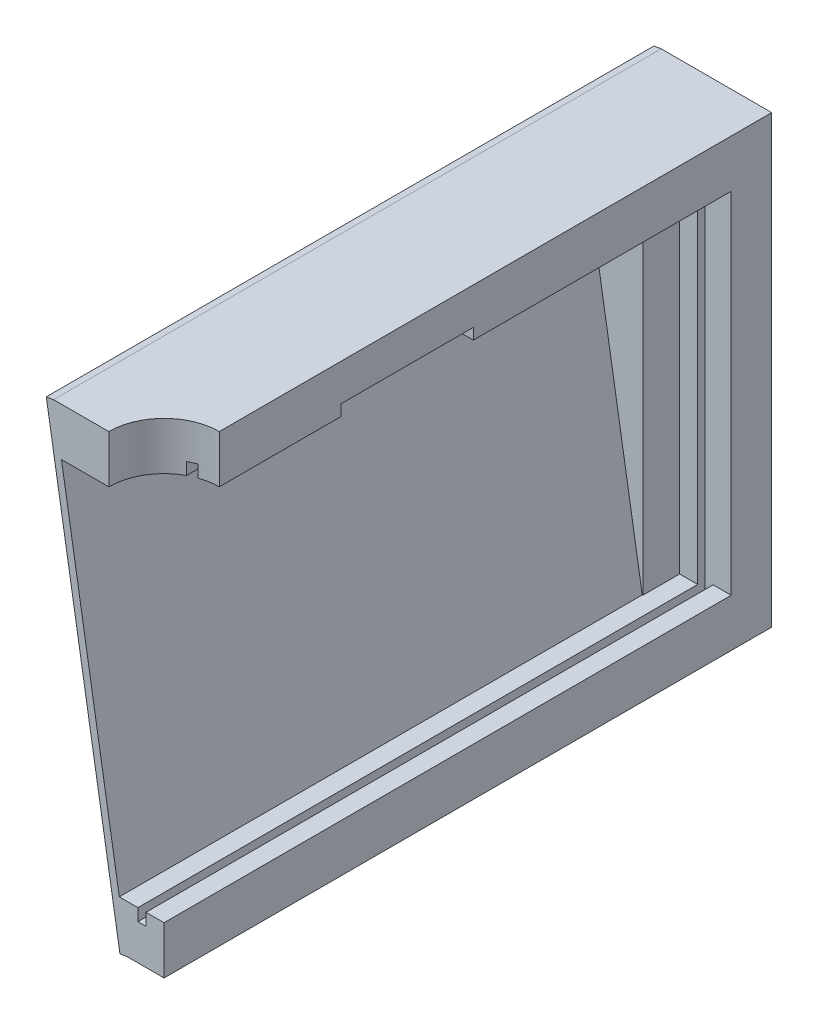
from build123d import *

# Parameters (mm, degrees)
BOSS_EXTRUDE3_DEPTH = 40
SKETCH4_W           = 2
SKETCH4_H           = 142
CUT_EXTRUDE1_DEPTH  = 3
SKETCH5_W           = 2
SKETCH5_H           = 98
CUT_EXTRUDE2_DEPTH  = 3
SKETCH6_W           = 2
SKETCH6_H           = 145
CUT_EXTRUDE3_DEPTH  = 3
CUT_EXTRUDE4_DEPTH  = 228
SKETCH8_W           = 165
SKETCH8_H           = 122.641754717
BOSS_EXTRUDE5_DEPTH = 2
SKETCH11_W          = 2
SKETCH11_H          = 0.3
CUT_EXTRUDE5_DEPTH  = 145
SKETCH12_W          = 2
SKETCH12_H          = 0.3
CUT_EXTRUDE6_DEPTH  = 145
SKETCH16_W          = 2
SKETCH16_H          = 101.6
CUT_EXTRUDE7_DEPTH  = 154
SKETCH17_W          = 10
SKETCH17_H          = 95
CUT_EXTRUDE9_DEPTH  = 12
SKETCH18_W          = 5
SKETCH18_H          = 5
CUT_EXTRUDE10_DEPTH = 56
SKETCH19_W          = 36
SKETCH19_H          = 3
CUT_EXTRUDE11_DEPTH = 6
CUT_EXTRUDE13_DEPTH = 27
SKETCH22_W          = 2
SKETCH22_H          = 95
CUT_EXTRUDE22_DEPTH = 5
CUT_EXTRUDE23_DEPTH = 154


with BuildPart() as part:
    # Sketch2 → Boss-Extrude3 (new body)
    with BuildSketch(Plane(origin=(0, 0, 0), x_dir=(0, 0, -1), z_dir=(1, 0, 0))):
        Polygon((-34.1264251, 9.12857495), (-34.1264251, -3.87142505), (130.8735749, -3.87142505), (130.8735749, 117.12857495), (-34.1264251, 117.12857495), (-34.1264251, 104.12857495), (107.8735749, 104.12857495), (107.8735749, 9.12857495), align=None)
    extrude(amount=BOSS_EXTRUDE3_DEPTH)

    # Sketch4 → Cut-Extrude1 (cut)
    with BuildSketch(Plane.XZ.offset(-104.12857495)):
        with Locations((34, -36.8735749)):
            Rectangle(SKETCH4_W, SKETCH4_H)
    extrude(amount=-CUT_EXTRUDE1_DEPTH, mode=Mode.SUBTRACT)

    # Sketch5 → Cut-Extrude2 (cut)
    with BuildSketch(Plane.XY.offset(-107.8735749)):
        with Locations((34, 58.12857495)):
            Rectangle(SKETCH5_W, SKETCH5_H)
    extrude(amount=-CUT_EXTRUDE2_DEPTH, mode=Mode.SUBTRACT)

    # Sketch6 → Cut-Extrude3 (cut)
    with BuildSketch(Plane(origin=(0, 9.12857495, 0), x_dir=(1, 0, 0), z_dir=(0, 1, 0))):
        with Locations((34, 38.3735749)):
            Rectangle(SKETCH6_W, SKETCH6_H)
    extrude(amount=-CUT_EXTRUDE3_DEPTH, mode=Mode.SUBTRACT)

    # Sketch7 → Cut-Extrude4 (cut)
    with BuildSketch(Plane(origin=(0, 0, -130.8735749), x_dir=(-1, 0, 0), z_dir=(0, 0, -1))):
        Polygon((0, 117.12857495), (0, -3.87142505), (-30, -3.87142505), (-10, 117.12857495), align=None)
    extrude(amount=-CUT_EXTRUDE4_DEPTH, mode=Mode.SUBTRACT)

    # Sketch8 → Boss-Extrude5 (add)
    with BuildSketch(Plane(origin=(28.579293357, 4.723850142, 0), x_dir=(0, 0, 1), z_dir=(-0.986613411390535, -0.16307659692405535, 0))):
        with Locations((-48.3735749, 52.608979576)):
            Rectangle(SKETCH8_W, SKETCH8_H)
    extrude(amount=BOSS_EXTRUDE5_DEPTH)

    # Sketch11 → Cut-Extrude5 (cut)
    with BuildSketch(Plane.XY.offset(34.1264251)):
        with Locations((34, 107.27857495)):
            Rectangle(SKETCH11_W, SKETCH11_H)
    extrude(amount=-CUT_EXTRUDE5_DEPTH, mode=Mode.SUBTRACT)

    # Sketch12 → Cut-Extrude6 (cut)
    with BuildSketch(Plane.XY.offset(34.1264251)):
        with Locations((34, 5.97857495)):
            Rectangle(SKETCH12_W, SKETCH12_H)
    extrude(amount=-CUT_EXTRUDE6_DEPTH, mode=Mode.SUBTRACT)

    # Sketch16 → Cut-Extrude7 (cut)
    with BuildSketch(Plane.XY.offset(34.1264251)):
        with Locations((34, 56.62857495)):
            Rectangle(SKETCH16_W, SKETCH16_H)
    extrude(amount=-CUT_EXTRUDE7_DEPTH, mode=Mode.SUBTRACT)

    # Sketch17 → Cut-Extrude9 (cut)
    with BuildSketch(Plane(origin=(40, 0, 0), x_dir=(0, 0, -1), z_dir=(1, 0, 0))):
        with Locations((112.8735749, 56.62857495)):
            Rectangle(SKETCH17_W, SKETCH17_H)
    extrude(amount=-CUT_EXTRUDE9_DEPTH, mode=Mode.SUBTRACT)

    # Sketch18 → Cut-Extrude10 (cut)
    with BuildSketch(Plane.XZ.offset(-104.12857495)):
        with Locations((30.5, 31.6264251)):
            Rectangle(SKETCH18_W, SKETCH18_H)
    extrude(amount=-CUT_EXTRUDE10_DEPTH, mode=Mode.SUBTRACT)

    # Sketch19 → Cut-Extrude11 (cut)
    with BuildSketch(Plane(origin=(40, 0, 0), x_dir=(0, 0, -1), z_dir=(1, 0, 0))):
        with Locations((31.8735749, 105.62857495)):
            Rectangle(SKETCH19_W, SKETCH19_H)
    extrude(amount=-CUT_EXTRUDE11_DEPTH, mode=Mode.SUBTRACT)

    # Sketch20 → Cut-Extrude13 (cut)
    with BuildSketch(Plane(origin=(0, 117.12857495, 0), x_dir=(1, 0, 0), z_dir=(0, 1, 0))):
        with BuildLine():
            Line((33, -34.1264251), (40, -34.1264251))
            Line((40, -34.1264251), (40, -19.1264251))
            ThreePointArc((40, -19.1264251), (29.393398282, -23.519823382), (25, -34.1264251))
            Line((25, -34.1264251), (28, -34.1264251))
            Line((28, -34.1264251), (28, -29.1264251))
            Line((28, -29.1264251), (33, -29.1264251))
            Line((33, -29.1264251), (33, -34.1264251))
        make_face()
    extrude(amount=-CUT_EXTRUDE13_DEPTH, mode=Mode.SUBTRACT)

    # Sketch22 → Cut-Extrude22 (cut)
    with BuildSketch(Plane(origin=(40, 0, 0), x_dir=(0, 0, -1), z_dir=(1, 0, 0))):
        with Locations((118.8735749, 56.62857495)):
            Rectangle(SKETCH22_W, SKETCH22_H)
    extrude(amount=-CUT_EXTRUDE22_DEPTH, mode=Mode.SUBTRACT)

    # Sketch23 → Cut-Extrude23 (cut)
    with BuildSketch(Plane.XY.offset(34.1264251)):
        Polygon((33, 5.82857495), (35, 5.82857495), (35.1, 5.82857495), (35.1, 107.42857495), (35, 107.42857495), (33, 107.42857495), (32.9, 107.42857495), (32.9, 5.82857495), align=None)
    extrude(amount=-CUT_EXTRUDE23_DEPTH, mode=Mode.SUBTRACT)


solid = part.part
